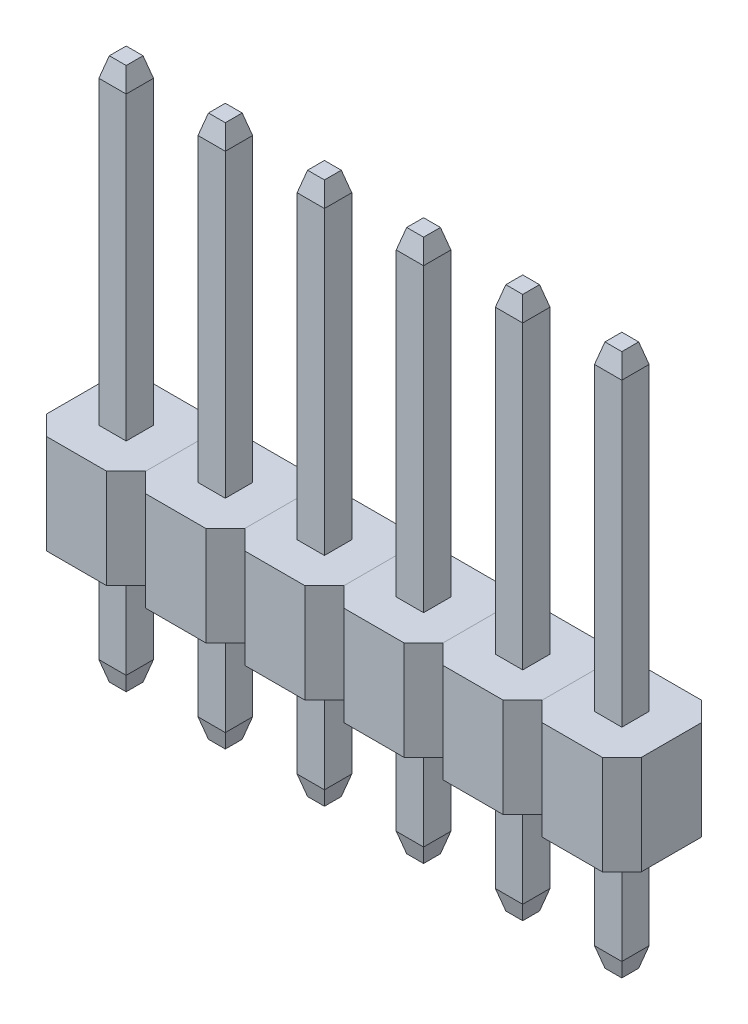
from build123d import *

# Parameters (mm, degrees)
SKETCH3_W           = 2.54
SKETCH3_H           = 2.54
SKETCH3_W_2         = 0.635
SKETCH3_H_2         = 0.635
BOSS_EXTRUDE1_DEPTH = 1.27
CHAMFER1_SIZE       = 0.5
BOSS_EXTRUDE2_START = -5.2
SKETCH5_W           = 0.7
SKETCH5_H           = 0.7
BOSS_EXTRUDE2_DEPTH = 12.9
SKETCH6_W           = 0.7
SKETCH6_H           = 0.7
BOSS_EXTRUDE3_DEPTH = 0.5
BOSS_EXTRUDE3_TAPER = 15
SKETCH7_W           = 0.7
SKETCH7_H           = 0.7
BOSS_EXTRUDE4_DEPTH = 0.5
BOSS_EXTRUDE4_TAPER = 15
LPATTERN1_COUNT     = 6
LPATTERN1_PITCH     = 2.54


with BuildPart() as part:
    # Sketch3 → Boss-Extrude1 (new, symmetric)
    with BuildSketch(Plane(origin=(0, 0, 0), x_dir=(1, 0, 0), z_dir=(0, 1, 0))):
        Rectangle(SKETCH3_W, SKETCH3_H)
        Rectangle(SKETCH3_W_2, SKETCH3_H_2, mode=Mode.SUBTRACT)
    extrude(amount=BOSS_EXTRUDE1_DEPTH, both=True)

    # Chamfer1
    chamfer1_edges = [part.edges().sort_by_distance(p)[0] for p in [
        (1.27, 0, 1.27),
        (-1.27, 0, 1.27),
        (-1.27, 0, -1.27),
        (1.27, 0, -1.27),
    ]]
    chamfer(chamfer1_edges, length=CHAMFER1_SIZE)


with BuildPart() as body_2:
    # Sketch5 → Boss-Extrude2 (new body)
    with BuildSketch(Plane(origin=(0, 1.27, 0), x_dir=(1, 0, 0), z_dir=(0, 1, 0)).offset(BOSS_EXTRUDE2_START)):
        Rectangle(SKETCH5_W, SKETCH5_H)
    extrude(amount=BOSS_EXTRUDE2_DEPTH)

    # Sketch6 → Boss-Extrude3 (add)
    with BuildSketch(Plane(origin=(0, 8.97, 0), x_dir=(1, 0, 0), z_dir=(0, 1, 0))):
        Rectangle(SKETCH6_W, SKETCH6_H)
    extrude(amount=BOSS_EXTRUDE3_DEPTH, taper=BOSS_EXTRUDE3_TAPER)

    # Sketch7 → Boss-Extrude4 (add)
    with BuildSketch(Plane.XZ.offset(3.93)):
        Rectangle(SKETCH7_W, SKETCH7_H)
    extrude(amount=BOSS_EXTRUDE4_DEPTH, taper=BOSS_EXTRUDE4_TAPER)


with BuildPart() as lpattern1_1:
    # LPattern1: pattern copy
    add(body_2.part.moved(Location(Vector(1, 0, 0) * (1 * LPATTERN1_PITCH))))


with BuildPart() as lpattern1_2:
    # LPattern1: pattern copy
    add(body_2.part.moved(Location(Vector(1, 0, 0) * (2 * LPATTERN1_PITCH))))


with BuildPart() as lpattern1_3:
    # LPattern1: pattern copy
    add(body_2.part.moved(Location(Vector(1, 0, 0) * (3 * LPATTERN1_PITCH))))


with BuildPart() as lpattern1_4:
    # LPattern1: pattern copy
    add(body_2.part.moved(Location(Vector(1, 0, 0) * (4 * LPATTERN1_PITCH))))


with BuildPart() as lpattern1_5:
    # LPattern1: pattern copy
    add(body_2.part.moved(Location(Vector(1, 0, 0) * (5 * LPATTERN1_PITCH))))


with BuildPart() as lpattern1_6:
    # LPattern1: pattern copy
    add(part.part.moved(Location(Vector(1, 0, 0) * (1 * LPATTERN1_PITCH))))


with BuildPart() as lpattern1_7:
    # LPattern1: pattern copy
    add(part.part.moved(Location(Vector(1, 0, 0) * (2 * LPATTERN1_PITCH))))


with BuildPart() as lpattern1_8:
    # LPattern1: pattern copy
    add(part.part.moved(Location(Vector(1, 0, 0) * (3 * LPATTERN1_PITCH))))


with BuildPart() as lpattern1_9:
    # LPattern1: pattern copy
    add(part.part.moved(Location(Vector(1, 0, 0) * (4 * LPATTERN1_PITCH))))


with BuildPart() as lpattern1_10:
    # LPattern1: pattern copy
    add(part.part.moved(Location(Vector(1, 0, 0) * (5 * LPATTERN1_PITCH))))


solid = Compound([part.part, body_2.part, lpattern1_1.part, lpattern1_2.part, lpattern1_3.part, lpattern1_4.part, lpattern1_5.part, lpattern1_6.part, lpattern1_7.part, lpattern1_8.part, lpattern1_9.part, lpattern1_10.part])
